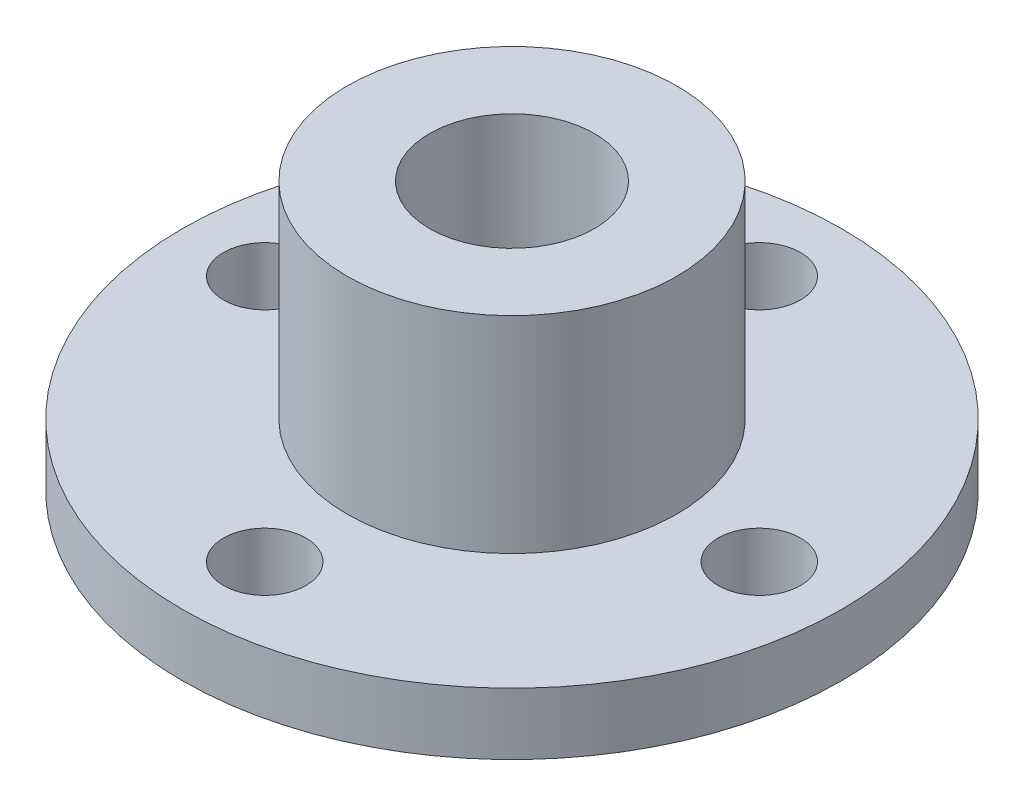
from build123d import *

# Parameters (mm, degrees)
SKETCH1_R           = 16
BOSS_EXTRUDE1_DEPTH = 3
SKETCH2_R           = 8
BOSS_EXTRUDE2_DEPTH = 10
SKETCH3_R           = 4
CUT_EXTRUDE1_DEPTH  = 10
SKETCH4_R           = 2
CUT_EXTRUDE2_DEPTH  = 10


with BuildPart() as part:
    # Sketch1 → Boss-Extrude1 (new body)
    with BuildSketch(Plane(origin=(0, 0, 0), x_dir=(1, 0, 0), z_dir=(0, 1, 0))):
        with Locations(Location((0, 0, 0), (0, 0, 270))):
            Circle(SKETCH1_R)
    extrude(amount=BOSS_EXTRUDE1_DEPTH)

    # Sketch2 → Boss-Extrude2 (add)
    with BuildSketch(Plane(origin=(0, 3, 0), x_dir=(1, 0, 0), z_dir=(0, 1, 0))):
        with Locations(Location((0, 0, 0), (0, 0, 270))):
            Circle(SKETCH2_R)
    extrude(amount=BOSS_EXTRUDE2_DEPTH)

    # Sketch3 → Cut-Extrude1 (cut)
    with BuildSketch(Plane(origin=(0, 13, 0), x_dir=(1, 0, 0), z_dir=(0, 1, 0))):
        with Locations(Location((0, 0, 0), (0, 0, 270))):
            Circle(SKETCH3_R)
    extrude(amount=-CUT_EXTRUDE1_DEPTH, mode=Mode.SUBTRACT)

    # Sketch4 → Cut-Extrude2 (cut)
    with BuildSketch(Plane(origin=(0, 3, 0), x_dir=(1, 0, 0), z_dir=(0, 1, 0))):
        with Locations(Location((0, 12, 0), (0, 0, 270))):
            Circle(SKETCH4_R)
        with Locations(Location((-12, 0, 0), (0, 0, 270))):
            Circle(SKETCH4_R)
        with Locations(Location((0, -12, 0), (0, 0, 270))):
            Circle(SKETCH4_R)
        with Locations(Location((12, 0, 0), (0, 0, 270))):
            Circle(SKETCH4_R)
    extrude(amount=-CUT_EXTRUDE2_DEPTH, mode=Mode.SUBTRACT)


solid = part.part
